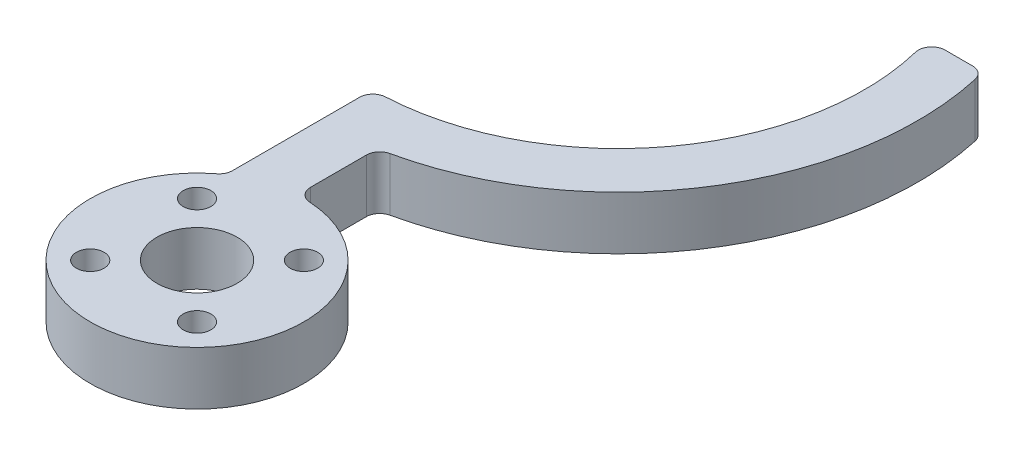
from build123d import *

# Parameters (mm, degrees)
SKETCH1_R           = 2.075
SKETCH1_R_2         = 6.003208263
BOSS_EXTRUDE2_DEPTH = 8
FILLET1_R           = 2
CUT_EXTRUDE1_DEPTH  = 10
FILLET2_R           = 2
CUT_EXTRUDE2_DEPTH  = 10
FILLET3_R           = 2


with BuildPart() as part:
    # Sketch1 → Boss-Extrude2 (new body)
    with BuildSketch(Plane(origin=(0, 0, 0), x_dir=(1, 0, 0), z_dir=(0, 1, 0))):
        with BuildLine():
            Line((0, 44.83), (0, 36.83))
            ThreePointArc((0, 36.83), (36.83, 0), (0, -36.83))
            Line((0, -36.83), (0, -46.83))
            Line((0, -46.83), (0, -58.83))
            ThreePointArc((0, -58.83), (14.116701064, -87.229775601), (8, -56.110417137))
            Line((8, -56.110417137), (8, -44.110417137))
            ThreePointArc((8, -44.110417137), (44.649741882, 4.016148637), (0, 44.83))
        make_face()
        with Locations(Location((0.96696537, -64.081170969, 0), (0, 0, 270))):
            Circle(SKETCH1_R, mode=Mode.SUBTRACT)
        with Locations(Location((16.96696537, -64.081170969, 0), (0, 0, 270))):
            Circle(SKETCH1_R, mode=Mode.SUBTRACT)
        with Locations(Location((16.96696537, -80.081170969, 0), (0, 0, 270))):
            Circle(SKETCH1_R, mode=Mode.SUBTRACT)
        with Locations(Location((0.96696537, -80.081170969, 0), (0, 0, 270))):
            Circle(SKETCH1_R, mode=Mode.SUBTRACT)
        with Locations(Location((8.96696537, -72.081170969, 0), (0, 0, 270))):
            Circle(SKETCH1_R_2, mode=Mode.SUBTRACT)
    extrude(amount=BOSS_EXTRUDE2_DEPTH)

    # Fillet1
    fillet1_edges = [part.edges().sort_by_distance(p)[0] for p in [
        (0, 4, 58.83),
        (0, 4, 36.83),
        (0, 4, -36.83),
        (0, 4, -44.83),
        (8, 4, 44.110417137),
        (8, 4, 56.110417137),
    ]]
    fillet(fillet1_edges, radius=FILLET1_R)

    # Sketch2 → Cut-Extrude1 (cut)
    with BuildSketch(Plane(origin=(0, 8, 0), x_dir=(1, 0, 0), z_dir=(0, 1, 0))):
        with BuildLine():
            Line((41.799027506, 16.204018007), (33.073837099, 16.204018007))
            ThreePointArc((33.073837099, 16.204018007), (20.287775905, 30.738494576), (1.896986866, 36.781113915))
            ThreePointArc((1.896986866, 36.781113915), (0.549823068, 37.401147764), (0, 38.778459227))
            Line((0, 38.778459227), (0, 42.783278276))
            Line((0, 42.783278276), (0, 44.783278276))
            Line((0, 44.783278276), (-0.257809332, 46.655742188))
            Line((-0.257809332, 46.655742188), (2.752058537, 46.655742188))
            Line((2.752058537, 46.655742188), (2.752058537, 44.782949944))
            ThreePointArc((2.752058537, 44.782949944), (26.871190964, 36.772449298), (41.799027506, 16.204018007))
        make_face()
    extrude(amount=-CUT_EXTRUDE1_DEPTH, mode=Mode.SUBTRACT)

    # Fillet2
    fillet2_edges = [part.edges().sort_by_distance(p)[0] for p in [
        (41.799027506, 4, -16.204018007),
        (33.073837099, 4, -16.204018007),
    ]]
    fillet(fillet2_edges, radius=FILLET2_R)

    # Sketch3 → Cut-Extrude2 (cut)
    with BuildSketch(Plane(origin=(0, 8, 0), x_dir=(1, 0, 0), z_dir=(0, 1, 0))):
        Polygon((34.701551804, 11.204018007), (33.222316064, 16.570796176), (43.892135876, 17.266509565), (44.733726157, 11.204018007), align=None)
    extrude(amount=-CUT_EXTRUDE2_DEPTH, mode=Mode.SUBTRACT)

    # Fillet3
    fillet3_edges = [part.edges().sort_by_distance(p)[0] for p in [
        (43.40735975, 4, -11.204018007),
        (35.084453544, 4, -11.204018007),
    ]]
    fillet(fillet3_edges, radius=FILLET3_R)


solid = part.part
